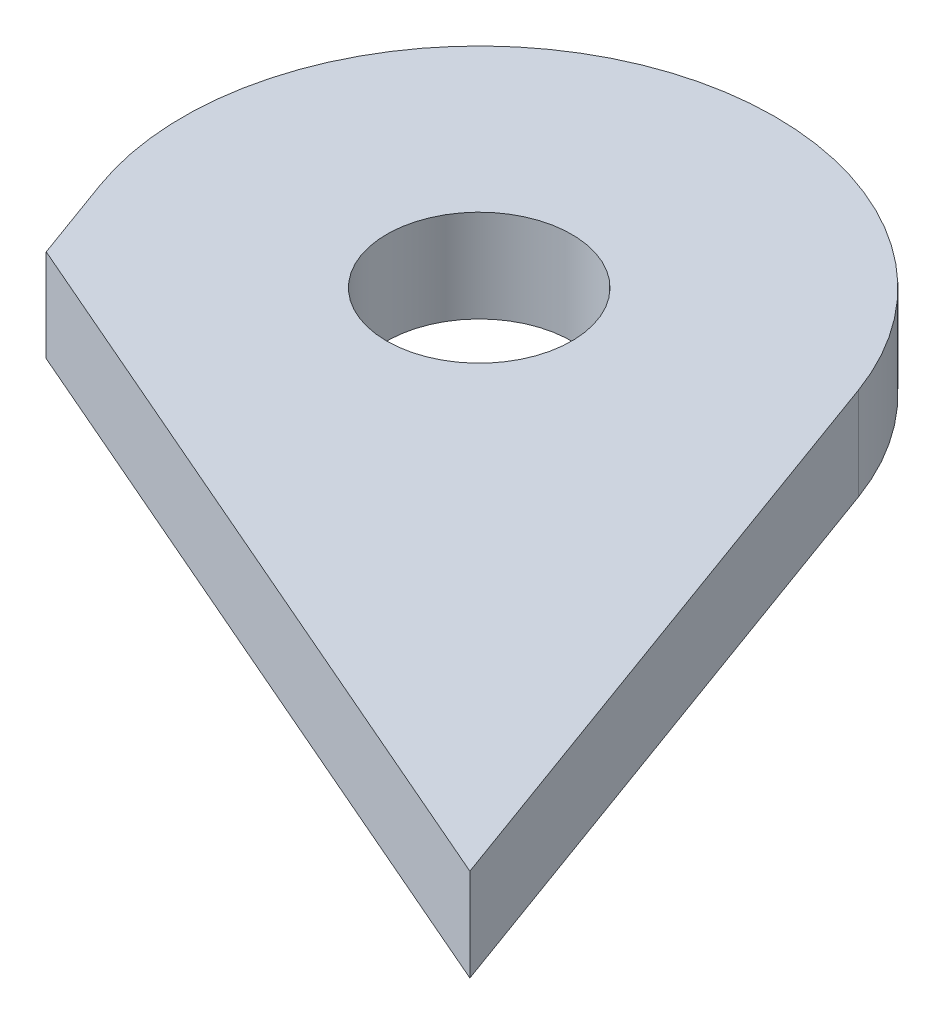
from build123d import *

# Parameters (mm, degrees)
SKETCH1_R           = 6.35
BOSS_EXTRUDE1_DEPTH = 6.35


with BuildPart() as part:
    # Sketch1 → Boss-Extrude1 (new body)
    with BuildSketch(Plane(origin=(0, 0, 0), x_dir=(1, 0, 0), z_dir=(0, 1, 0))):
        with BuildLine():
            Line((19.094554054, 6.949849312), (34.365509447, -35.006755803))
            Line((34.365509447, -35.006755803), (-16.990886166, -12.729629333))
            Line((-16.990886166, -12.729629333), (-19.094554054, -6.949849312))
            ThreePointArc((-19.094554054, -6.949849312), (-6.949849312, 19.094554054), (19.094554054, 6.949849312))
        make_face()
        with Locations(Location((0, 0, 0), (0, 0, 270))):
            Circle(SKETCH1_R, mode=Mode.SUBTRACT)
    extrude(amount=BOSS_EXTRUDE1_DEPTH)


solid = part.part
